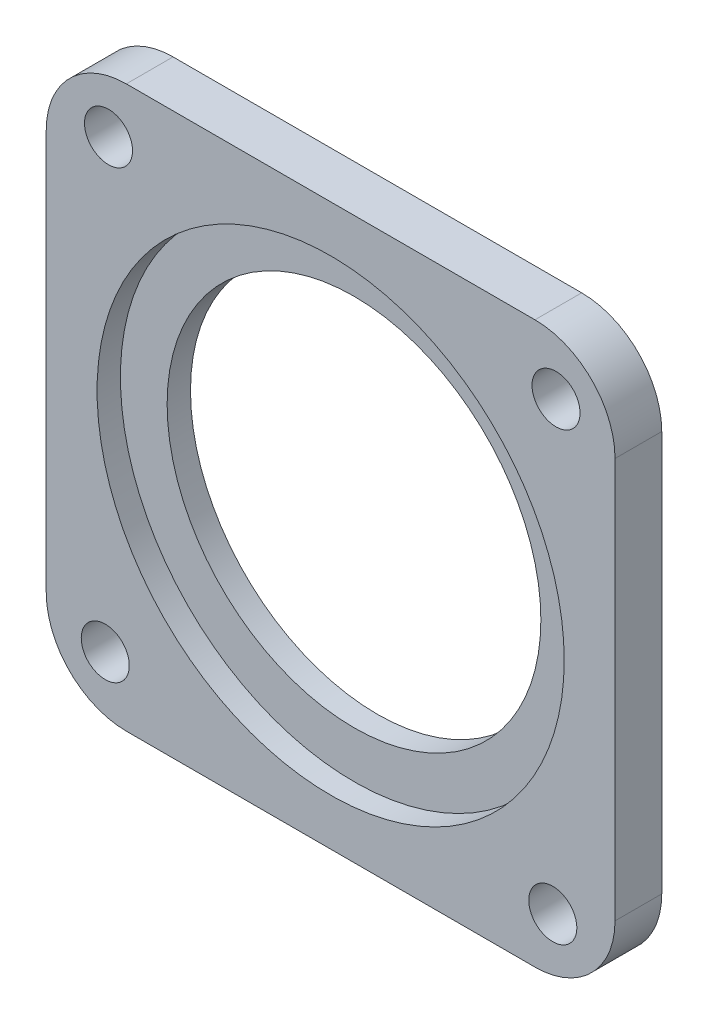
from build123d import *

# Parameters (mm, degrees)
SKETCH1_W            = 42.614634146
SKETCH1_H            = 42
SKETCH1_R            = 14
BOSS_EXTRUDE1_DEPTH  = 3.5
SKETCH2_R            = 17.5
CUT_EXTRUDE1_DEPTH   = 1.75
M3_CLEARANCE_HOLE1_D = 3.6
FILLET1_R            = 6


with BuildPart() as part:
    # Sketch1 → Boss-Extrude1 (new body)
    with BuildSketch(Plane.XY):
        Rectangle(SKETCH1_W, SKETCH1_H)
        Circle(SKETCH1_R, mode=Mode.SUBTRACT)
    extrude(amount=BOSS_EXTRUDE1_DEPTH)

    # Sketch2 → Cut-Extrude1 (cut)
    with BuildSketch(Plane.XY.offset(3.5)):
        Circle(SKETCH2_R)
    extrude(amount=-CUT_EXTRUDE1_DEPTH, mode=Mode.SUBTRACT)

    # M3 Clearance Hole1 (through all)
    with Locations(Plane(origin=(0, 0, 0), x_dir=(-1, 0, 0), z_dir=(0, 0, -1))):
        with Locations((-16.642079068, -16.885621688), (-16.885621688, 16.642079068), (16.642079068, 16.885621688), (16.885621688, -16.642079068)):
            Hole(M3_CLEARANCE_HOLE1_D / 2)

    # Fillet1
    fillet1_edges = [part.edges().sort_by_distance(p)[0] for p in [
        (-21.307317073, 21, 1.75),
        (21.307317073, 21, 1.75),
        (21.307317073, -21, 1.75),
        (-21.307317073, -21, 1.75),
    ]]
    fillet(fillet1_edges, radius=FILLET1_R)


solid = part.part
